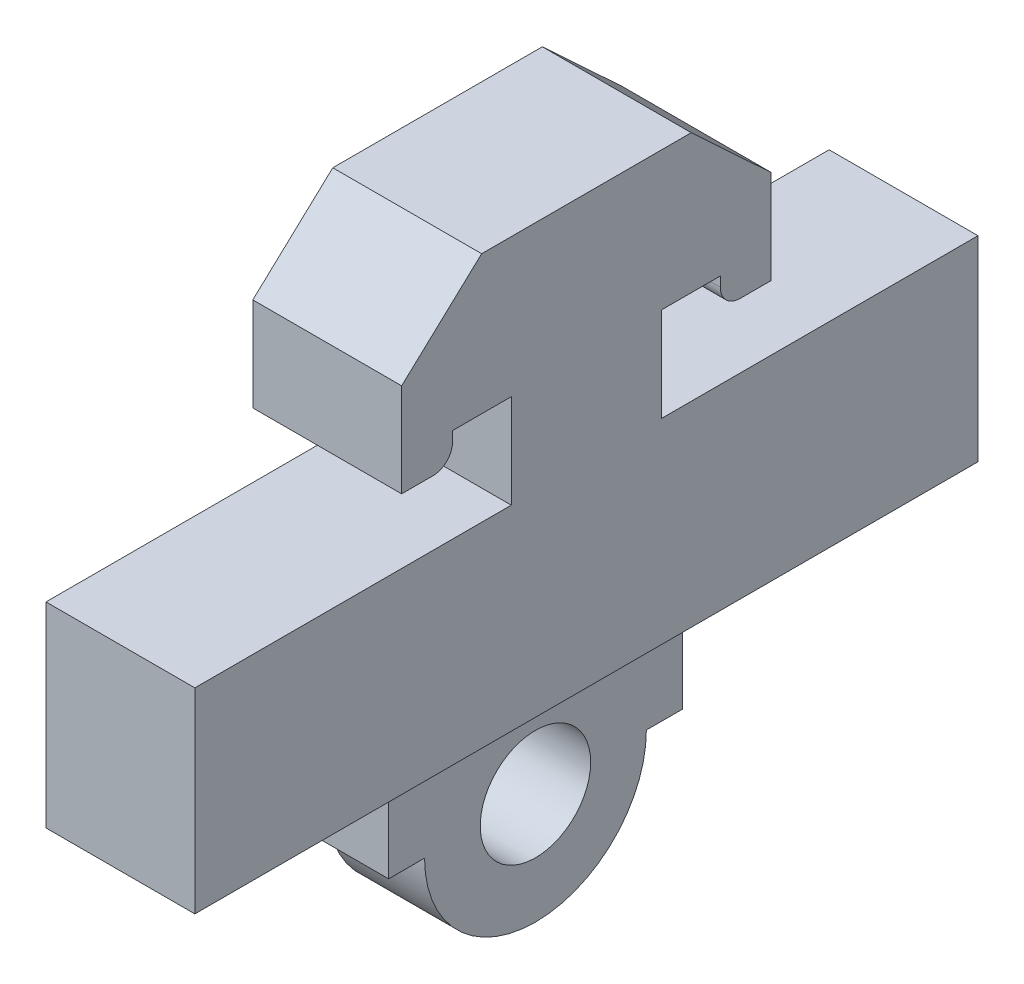
from build123d import *

# Parameters (mm, degrees)
SKETCH1_W           = 74.8
SKETCH1_H           = 40
BOSS_EXTRUDE1_DEPTH = 10
BOSS_EXTRUDE2_DEPTH = 5
BOSS_EXTRUDE3_DEPTH = 84.8
SKETCH4_W           = 77.196671852
SKETCH4_H           = 40
CUT_EXTRUDE1_DEPTH  = 59


with BuildPart() as part:
    # Sketch1 → Boss-Extrude1 (new body)
    with BuildSketch(Plane(origin=(0, 0, 0), x_dir=(1, 0, 0), z_dir=(0, 1, 0))):
        Rectangle(SKETCH1_W, SKETCH1_H)
    extrude(amount=BOSS_EXTRUDE1_DEPTH)

    # Sketch2 → Boss-Extrude2 (add)
    # profile 1 of 2: a face of its own
    with BuildSketch(Plane(origin=(37.4, 0, 0), x_dir=(0, 0, -1), z_dir=(1, 0, 0))):
        with BuildLine():
            Line((7.5, 0), (-7.5, 0))
            Line((-7.5, 0), (-7.5, -6))
            Line((-7.5, -6), (-5.665, -6))
            ThreePointArc((-5.665, -6), (0, -11.665), (5.665, -6))
            Line((5.665, -6), (7.5, -6))
            Line((7.5, -6), (7.5, 0))
        make_face()
        with BuildLine():
            ThreePointArc((2.82, -6), (0, -8.82), (-2.82, -6))
            ThreePointArc((-2.82, -6), (0, -3.18), (2.82, -6))
        make_face(mode=Mode.SUBTRACT)
    # profile 2 of 2: a face of its own
    with BuildSketch(Plane(origin=(37.4, 0, 0), x_dir=(0, 0, -1), z_dir=(1, 0, 0))):
        Polygon((-20, 0), (-7.5, 0), (7.5, 0), (20, 0), (20, 10), (-20, 10), align=None)
    boss_extrude2 = extrude(amount=BOSS_EXTRUDE2_DEPTH)

    # Mirror1: Boss-Extrude2 across plane
    add(boss_extrude2.mirror(Plane(origin=(0, 0, 0), x_dir=(0, 0, 1), z_dir=(1, 0, 0))))

    # Sketch3 → Boss-Extrude3 (add)
    with BuildSketch(Plane.ZY.offset(42.4)):
        with BuildLine():
            Line((-3.838227356, 14.8), (-3.838227356, 10))
            Line((-3.838227356, 10), (3.838227356, 10))
            Line((3.838227356, 10), (3.838227356, 14.8))
            Line((3.838227356, 14.8), (6.838227356, 14.8))
            Line((6.838227356, 14.8), (6.838227356, 14.3))
            ThreePointArc((6.838227356, 14.3), (7.131120575, 13.592893219), (7.838227356, 13.3))
            Line((7.838227356, 13.3), (9.438227356, 13.3))
            Line((9.438227356, 13.3), (9.438227356, 14.8))
            Line((9.438227356, 14.8), (9.438227356, 18.08))
            Line((9.438227356, 18.08), (5.3521045, 21.88))
            Line((5.3521045, 21.88), (-5.3521045, 21.88))
            Line((-5.3521045, 21.88), (-9.438227356, 18.08))
            Line((-9.438227356, 18.08), (-9.438227356, 14.8))
            Line((-9.438227356, 14.8), (-9.438227356, 13.3))
            Line((-9.438227356, 13.3), (-7.838227356, 13.3))
            ThreePointArc((-7.838227356, 13.3), (-7.131120575, 13.592893219), (-6.838227356, 14.3))
            Line((-6.838227356, 14.3), (-6.838227356, 14.8))
            Line((-6.838227356, 14.8), (-3.838227356, 14.8))
        make_face()
    extrude(amount=-BOSS_EXTRUDE3_DEPTH)

    # Sketch4 → Cut-Extrude1 (cut)
    with BuildSketch(Plane(origin=(0, 21.88, 0), x_dir=(1, 0, 0), z_dir=(0, 1, 0))):
        with Locations((3.801664074, 0)):
            Rectangle(SKETCH4_W, SKETCH4_H)
    extrude(amount=-CUT_EXTRUDE1_DEPTH, mode=Mode.SUBTRACT)


solid = part.part
